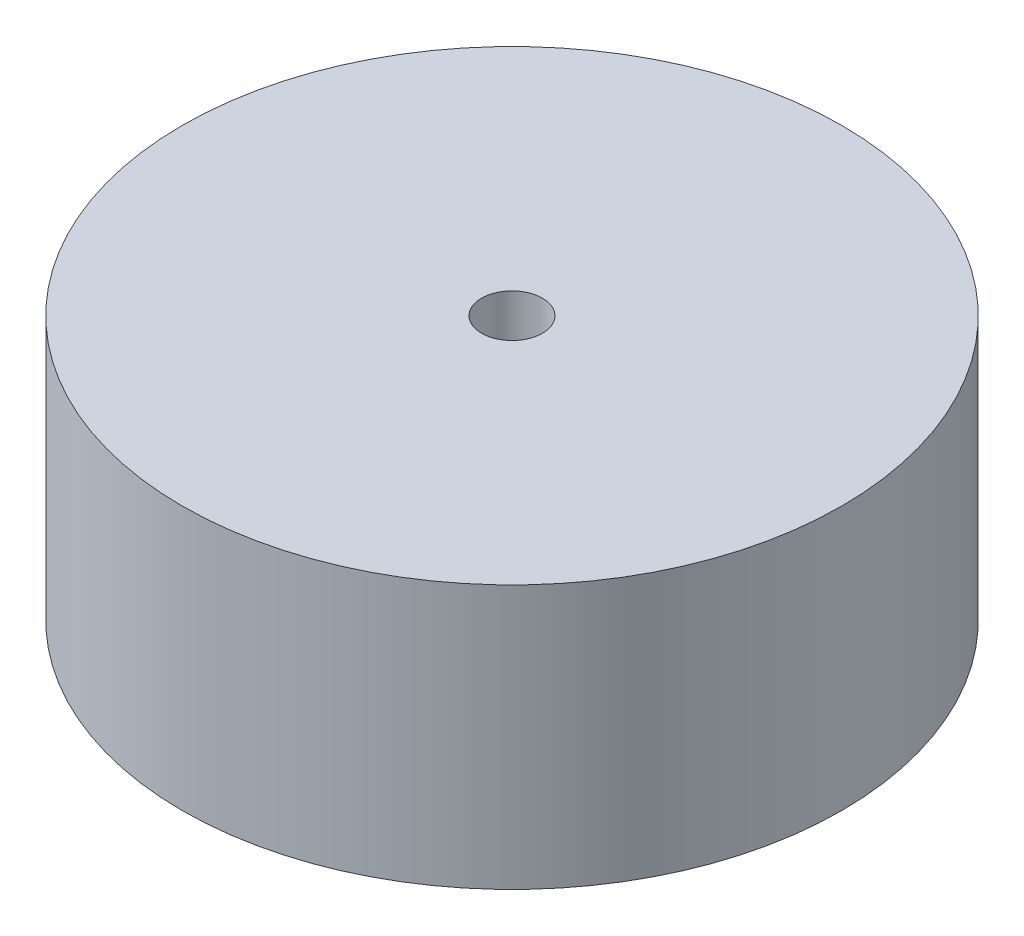
from build123d import *

# Parameters (mm, degrees)
SKETCH_1_R          = 32.5
EXTRUDE_1_DEPTH     = 26
SKETCH_2_R          = 6
EXTRUDE_2_DEPTH     = 4
SKETCH_3_R          = 3
CUT_EXTRUDE_1_DEPTH = 52


with BuildPart() as part:
    # 草图1 → 凸台-拉伸1 (new body)
    with BuildSketch(Plane(origin=(0, 0, 0), x_dir=(1, 0, 0), z_dir=(0, 1, 0))):
        with Locations(Location((0, 0, 0), (0, 0, 90))):
            Circle(SKETCH_1_R)
    extrude(amount=EXTRUDE_1_DEPTH)

    # 草图2 → 凸台-拉伸2 (add)
    with BuildSketch(Plane.XZ):
        with Locations(Location((0, 0, 0), (0, 0, 270))):
            Circle(SKETCH_2_R)
    extrude(amount=EXTRUDE_2_DEPTH)

    # 草图3 → 切除-拉伸1 (cut)
    with BuildSketch(Plane.XZ.offset(4)):
        with Locations(Location((0, 0, 0), (0, 0, 270))):
            Circle(SKETCH_3_R)
    extrude(amount=-CUT_EXTRUDE_1_DEPTH, mode=Mode.SUBTRACT)


solid = part.part
